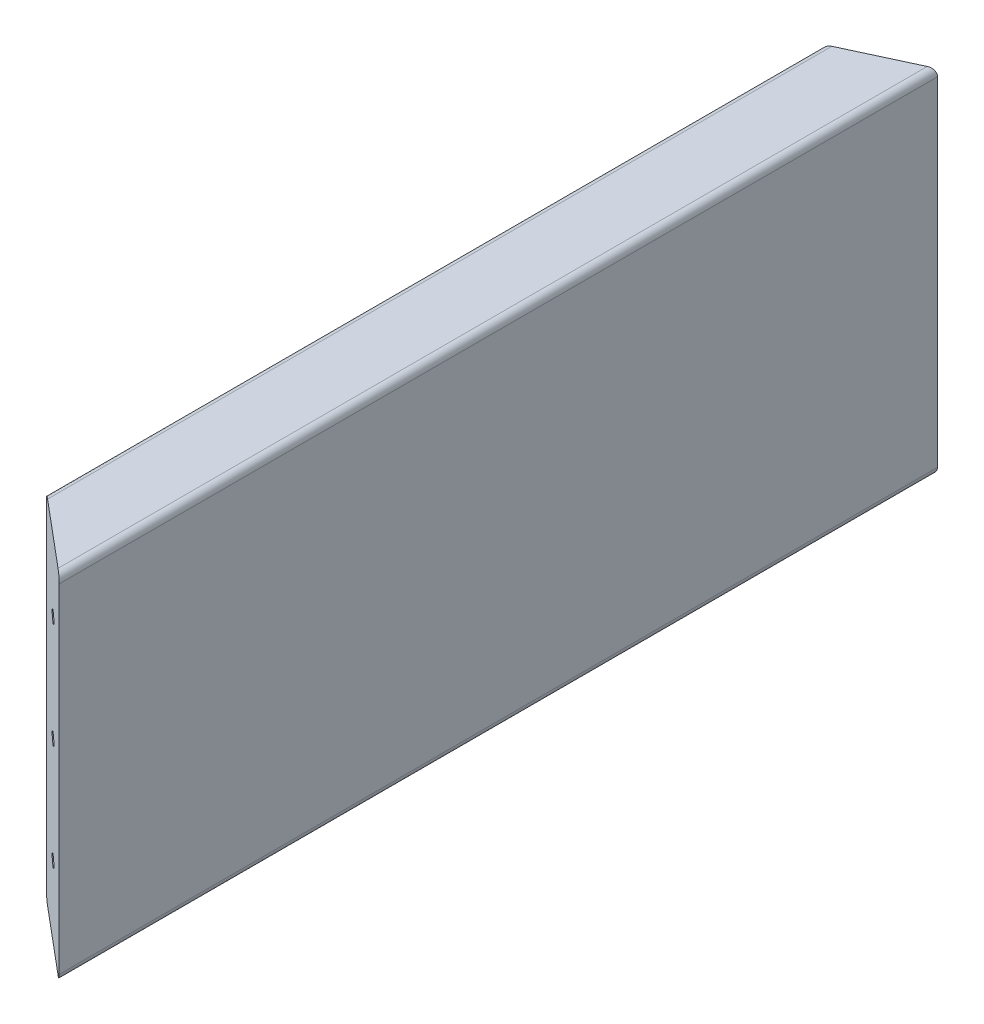
from build123d import *

# Parameters (mm, degrees)
SKETCH1_W                        = 45
SKETCH1_H                        = 200
BOSS_EXTRUDE1_DEPTH              = 510
FILLET1_R                        = 4
CUT_EXTRUDE1_DEPTH               = 549.700926986
CUT_EXTRUDE1_DEPTH_BACK          = 549.700926986
CUT_EXTRUDE2_DEPTH               = 539.19055733
CUT_EXTRUDE2_DEPTH_BACK          = 539.19055733
F_8_0MM_DOWEL_SLOT1_D            = 8
F_8_0MM_DOWEL_SLOT1_DEPTH        = 22.596557524
F_8_0MM_DOWEL_SLOT1_CSINK_D      = 8.05
F_8_0MM_DOWEL_SLOT1_CSINK_ANGLE  = 90
F_8_0MM_DOWEL_SLOT1_TIP          = 2.403442476
F_6_0MM_DOWEL_SLOT_D             = 6
F_6_0MM_DOWEL_SLOT_DEPTH         = 128.197418143
F_6_0MM_DOWEL_SLOT_CSINK_D       = 6.05
F_6_0MM_DOWEL_SLOT_CSINK_ANGLE   = 90
F_6_0MM_DOWEL_SLOT_TIP           = 1.802581857
F_6_0MM_DOWEL_SLOT4_D            = 6
F_6_0MM_DOWEL_SLOT4_DEPTH        = 10.197418143
F_6_0MM_DOWEL_SLOT4_TIP          = 1.802581857
F_6_0MM_DOWEL_SLOT17_D           = 6
F_6_0MM_DOWEL_SLOT17_DEPTH       = 28.197418143
F_6_0MM_DOWEL_SLOT17_CSINK_D     = 6.05
F_6_0MM_DOWEL_SLOT17_CSINK_ANGLE = 90
F_6_0MM_DOWEL_SLOT17_TIP         = 1.802581857


with BuildPart() as part:
    # Sketch1 → Boss-Extrude1 (new body)
    with BuildSketch(Plane.XY):
        with Locations((-8.688255411, 34.272684877)):
            Rectangle(SKETCH1_W, SKETCH1_H)
    extrude(amount=BOSS_EXTRUDE1_DEPTH)

    # Fillet1
    fillet1_edges = [part.edges().sort_by_distance(p)[0] for p in [
        (13.811744589, 134.272684877, 255),
        (13.811744589, -65.727315123, 255),
        (-31.188255411, -65.727315123, 255),
        (-31.188255411, 134.272684877, 255),
    ]]
    fillet(fillet1_edges, radius=FILLET1_R)

    # Sketch2 → Cut-Extrude1 (cut, two sides: drawn at the far end of the back side and taken through both)
    with BuildSketch(Plane(origin=(0, 134.272684877, 0), x_dir=(1, 0, 0), z_dir=(0, 1, 0)).offset(-CUT_EXTRUDE1_DEPTH_BACK)):
        Polygon((788.614470133, -1148.76248804), (13.811744589, -498.67461207), (-31.188255411, -460.917963243), (-805.990980955, 189.169912727), (-2106.166732895, -1360.435538361), (-511.561281807, -2698.367939128), align=None)
    extrude(amount=CUT_EXTRUDE1_DEPTH + CUT_EXTRUDE1_DEPTH_BACK, mode=Mode.SUBTRACT)

    # Sketch3 → Cut-Extrude2 (cut, two sides: drawn at the far end of the back side and taken through both)
    with BuildSketch(Plane(origin=(0, 134.272684877, 0), x_dir=(1, 0, 0), z_dir=(0, 1, 0)).offset(-CUT_EXTRUDE2_DEPTH_BACK)):
        Polygon((-948.658060529, -446.533100004), (-31.188255411, -20.877527163), (13.811744589, 0), (931.281549707, 425.655572841), (79.970404025, 2260.595183077), (-1799.969206211, 1388.406510232), align=None)
    extrude(amount=CUT_EXTRUDE2_DEPTH + CUT_EXTRUDE2_DEPTH_BACK, mode=Mode.SUBTRACT)

    # Ø8.0mm Dowel Slot1
    with Locations(Plane(origin=(-1225.746798414, -65.727315123, 575.087047823), x_dir=(-0.9071269657115731, 0, 0.4208570637151221), z_dir=(-0.4208570637151221, 0, -0.9071269657115731))):
        with Locations((-1339.359258027, 40), (-1339.359258027, 100), (-1339.359258027, 160)):
            CounterSinkHole(F_8_0MM_DOWEL_SLOT1_D / 2, F_8_0MM_DOWEL_SLOT1_CSINK_D / 2, depth=F_8_0MM_DOWEL_SLOT1_DEPTH, counter_sink_angle=F_8_0MM_DOWEL_SLOT1_CSINK_ANGLE)
            with Locations((0, 0, -(F_8_0MM_DOWEL_SLOT1_DEPTH + F_8_0MM_DOWEL_SLOT1_TIP / 2))):  # 118° drill point
                Cone(0, F_8_0MM_DOWEL_SLOT1_D / 2, F_8_0MM_DOWEL_SLOT1_TIP, mode=Mode.SUBTRACT)

    # Ø6.0mm Dowel Slot
    with Locations(Plane(origin=(-1255.768167205, -65.727315123, 566.463420302), x_dir=(1, 0, 0), z_dir=(0, 0, 1))):
        with Locations((1247.849951753, 160), (1247.849951753, 100), (1247.849951753, 40)):
            CounterSinkHole(F_6_0MM_DOWEL_SLOT_D / 2, F_6_0MM_DOWEL_SLOT_CSINK_D / 2, depth=F_6_0MM_DOWEL_SLOT_DEPTH, counter_sink_angle=F_6_0MM_DOWEL_SLOT_CSINK_ANGLE)
            with Locations((0, 0, -(F_6_0MM_DOWEL_SLOT_DEPTH + F_6_0MM_DOWEL_SLOT_TIP / 2))):  # 118° drill point
                Cone(0, F_6_0MM_DOWEL_SLOT_D / 2, F_6_0MM_DOWEL_SLOT_TIP, mode=Mode.SUBTRACT)

    # Ø6.0mm Dowel Slot4
    with Locations(Plane(origin=(-1324.714305528, -77.727315123, 452.529822169), x_dir=(0.642759292005894, 0, -0.766068203582476), z_dir=(0, -1, 0))):
        with Locations((-341.005231297, 740.318686522), (-261.339405676, 807.171930483), (-181.750714685, 873.960445306), (-102.007754434, 940.878418405), (-22.496198074, 1007.60220409), (847.496198074, 1007.60220409), (927.007754434, 940.878418405), (1006.750714685, 873.960445306), (1086.339405676, 807.171930483), (1166.005231297, 740.318686522)):
            Hole(F_6_0MM_DOWEL_SLOT4_D / 2, depth=F_6_0MM_DOWEL_SLOT4_DEPTH)
            with Locations((0, 0, -(F_6_0MM_DOWEL_SLOT4_DEPTH + F_6_0MM_DOWEL_SLOT4_TIP / 2))):  # 118° drill point
                Cone(0, F_6_0MM_DOWEL_SLOT4_D / 2, F_6_0MM_DOWEL_SLOT4_TIP, mode=Mode.SUBTRACT)

    # Ø6.0mm Dowel Slot17
    with Locations(Plane(origin=(-1324.714305529, -77.727315123, 452.529822169), x_dir=(0.642759292005894, 0, -0.766068203582476), z_dir=(0, -1, 0))):
        with Locations((22.5, 1726.5), (22.5, 1640.5), (802.5, 1726.5), (802.5, 1640.5), (22.5, -955.960621131), (22.5, -1636.5), (802.5, -1462.5), (802.5, -1636.5), (22.5, -1722.5), (802.5, -1722.5), (22.5, -1550.5), (802.5, -640.31), (120, -1722.5), (217.5, -1722.5), (315, -1722.5), (412.5, -1722.5), (510, -1722.5), (607.5, -1722.5), (705, -1722.5), (22.5, -861.25), (22.5, -883.75), (-22.496198074, -917.60220409), (802.5, -861.25), (802.5, -883.75), (847.496198074, -917.60220409), (802.5, -529.84), (22.5, -750.249617159), (-341.005231297, -650.318686522), (1166.005231297, -650.318686522), (-310.084924074, 22.5), (-310.084924074, 67.5), (22.5, 67.5), (22.5, 22.5), (802.5, 67.5), (802.5, 22.5), (1133.730020848, 67.5), (1133.730020848, 22.5), (1166.005231297, 740.318686522), (802.560751791, 973.75), (802.560751791, 951.25), (847.496198074, 1007.60220409), (-22.496198074, 1007.60220409), (22.560751791, 951.25), (-341.005231297, 740.318686522), (22.5, 1812.5), (802.5, 1812.5), (22.5, 1552.5), (802.5, 1552.5), (-102.162023695, -850.748960129), (-181.827849315, -783.895716167), (-261.493674936, -717.042472206), (927.162023695, -850.748960129), (1006.827849315, -783.895716167), (1086.493674936, -717.042472206), (1086.493674936, 807.042472206), (1006.827849315, 873.895716167), (927.162023695, 940.748960129), (-102.162023695, 940.748960129), (-181.827849315, 873.895716167), (-261.493674936, 807.042472206), (-199.224924074, 67.5), (-88.364924074, 67.5), (-199.224924074, 22.5), (-88.364924074, 22.5), (912.010020848, 67.5), (1022.870020848, 67.5), (912.010020848, 22.5), (1022.870020848, 22.5), (120, 67.5), (217.5, 67.5), (315, 67.5), (607.5, 67.5), (705, 67.5), (510, 67.5), (120, 22.5), (217.5, 22.5), (315, 22.5), (510, 22.5), (607.5, 22.5), (705, 22.5), (412.5, 22.5), (22.5, -750.78), (22.5, -640.31), (22.5, -529.84), (22.5, -419.37), (22.5, -308.9), (22.5, -198.43), (22.5, -87.96), (802.5, -750.78), (802.5, -419.37), (802.5, -308.9), (802.5, -198.43), (22.5, 177.97), (22.5, 288.44), (22.5, 398.91), (22.5, 509.38), (22.5, 619.85), (22.5, 730.32), (22.5, 840.79), (802.5, -87.96), (802.5, 177.97), (802.5, 288.44), (120.000330201, 1812.753749877), (217.5, 1812.5), (315, 1812.5), (412.5, 1812.5), (510, 1812.5), (607.5, 1812.5), (705, 1812.5), (120.060751791, 951.25), (217.560751791, 951.25), (315.060751791, 951.25), (412.560751791, 951.25), (510.060751791, 951.25), (607.560751791, 951.25), (705.060751791, 951.25), (656.310751791, 973.75), (558.810751791, 973.75), (461.310751791, 973.75), (363.810751791, 973.75), (266.310751791, 973.75), (168.810751791, 973.75), (120, -861.25), (217.5, -861.25), (315, -861.25), (412.5, -861.25), (510, -861.25), (607.5, -861.25), (705, -861.25), (656.25, -883.75), (558.75, -883.75), (461.25, -883.75), (168.75, -883.75), (266.25, -883.75), (363.75, -883.75), (802.560751791, -955.960621131), (412.5, 67.5), (802.5, 730.32), (802.560751791, 840.79), (802.5, 398.91), (802.5, 509.38), (802.5, 619.85), (-360.000025903, 699.425529794), (-360.000025903, -609.521258848), (-360.000025903, 598.725529794), (-360.000025903, 498.025529794), (-360.000025903, 397.325529794), (-360.000025903, 296.625529794), (-360.000025903, 195.925529794), (-360.000025903, 95.225529794), (-360.000025903, -5.474470206), (-360.000025903, -106.174470206), (-360.000025903, -206.874470206), (-360.000025903, -307.574470206), (-360.000025903, -408.274470206), (-360.000025903, -508.974470206), (1185.00101945, 699.425529452), (1185.000941829, 598.725529794), (1185.000864209, 498.025529794), (1185.000708968, 296.625529794), (1185.000631348, 195.925529794), (1185.000553727, 95.225529794), (1185.000476107, -5.474470206), (1185.000398486, -106.174470206), (1185.000320866, -206.874470206), (1185.000165625, -408.274470206), (1185.000088004, -508.974470206), (1185.000786589, 397.325529794), (22.560751791, 1016.385842825), (802.560751791, 1016.385842825), (802.560751791, -1550.5), (22.560751791, 973.75), (802.560751791, -363.966698641)):
            CounterSinkHole(F_6_0MM_DOWEL_SLOT17_D / 2, F_6_0MM_DOWEL_SLOT17_CSINK_D / 2, depth=F_6_0MM_DOWEL_SLOT17_DEPTH, counter_sink_angle=F_6_0MM_DOWEL_SLOT17_CSINK_ANGLE)
            with Locations((0, 0, -(F_6_0MM_DOWEL_SLOT17_DEPTH + F_6_0MM_DOWEL_SLOT17_TIP / 2))):  # 118° drill point
                Cone(0, F_6_0MM_DOWEL_SLOT17_D / 2, F_6_0MM_DOWEL_SLOT17_TIP, mode=Mode.SUBTRACT)


solid = part.part
